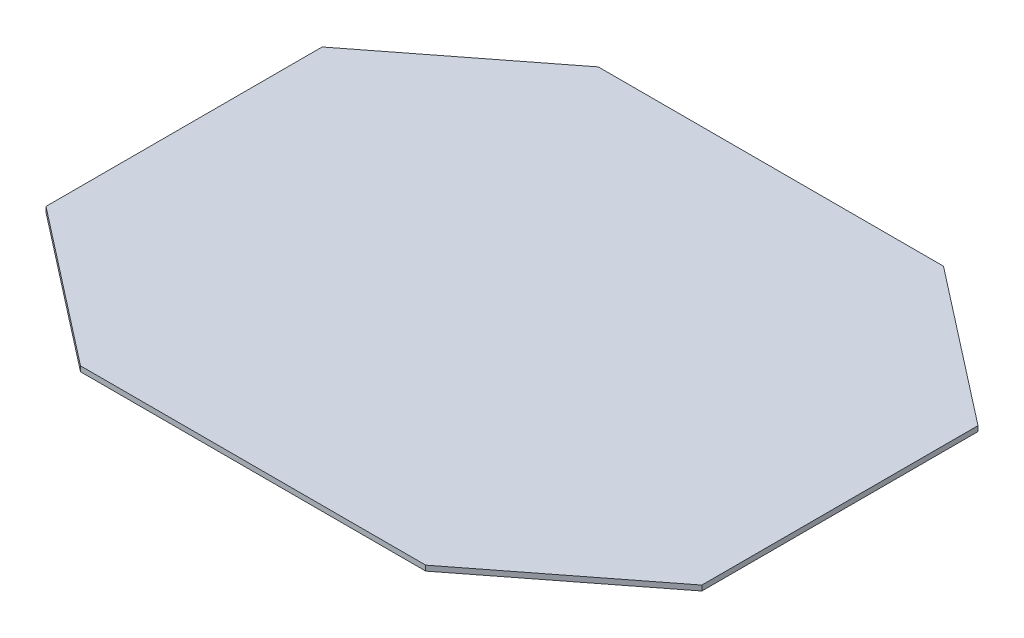
from build123d import *

# Parameters (mm, degrees)
BOSS_EXTRUDE1_DEPTH = 3


with BuildPart() as part:
    # Sketch1 → Boss-Extrude1 (new body)
    with BuildSketch(Plane(origin=(0, 0, 0), x_dir=(1, 0, 0), z_dir=(0, 1, 0))):
        Polygon((-100, 150), (100, 150), (190, 80), (190, 60), (190, -60), (190, -80), (100, -150), (-100, -150), (-190, -80), (-190, -60), (-190, 60), (-190, 80), align=None)
    extrude(amount=BOSS_EXTRUDE1_DEPTH)


solid = part.part
